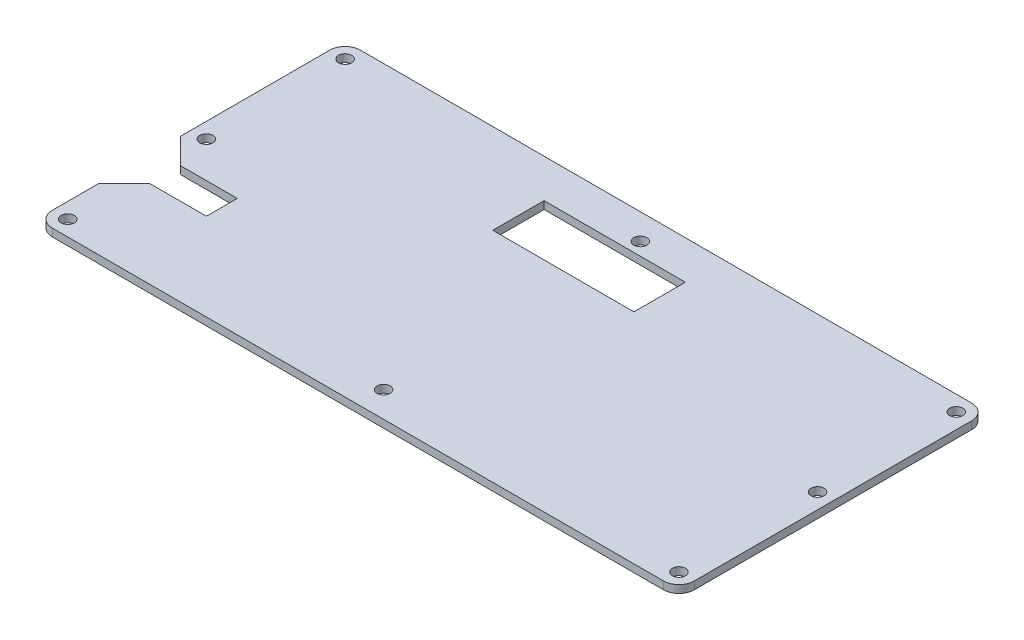
from build123d import *

# Parameters (mm, degrees)
SKETCH_1_R      = 2.55
SKETCH_1_W      = 55
SKETCH_1_H      = 20
EXTRUDE_1_DEPTH = 3


with BuildPart() as part:
    # 草图1 → 凸台-拉伸1 (new body)
    with BuildSketch(Plane(origin=(0, 0, 0), x_dir=(1, 0, 0), z_dir=(0, 1, 0))):
        with BuildLine():
            Line((16.20771131, 68.233643966), (16.20771131, 126.233643966))
            ThreePointArc((16.20771131, 126.233643966), (17.965070623, 130.476284653), (22.20771131, 132.233643966))
            Line((22.20771131, 132.233643966), (260.20771131, 132.233643966))
            ThreePointArc((260.20771131, 132.233643966), (264.450351998, 130.476284653), (266.20771131, 126.233643966))
            Line((266.20771131, 126.233643966), (266.20771131, 18.233643966))
            ThreePointArc((266.20771131, 18.233643966), (264.450351998, 13.991003279), (260.20771131, 12.233643966))
            Line((260.20771131, 12.233643966), (22.20771131, 12.233643966))
            ThreePointArc((22.20771131, 12.233643966), (17.965070623, 13.991003279), (16.20771131, 18.233643966))
            Line((16.20771131, 18.233643966), (16.20771131, 36.233643966))
            Line((16.20771131, 36.233643966), (26.20771131, 46.233643966))
            Line((26.20771131, 46.233643966), (48.20771131, 46.233643966))
            Line((48.20771131, 46.233643966), (48.20771131, 58.233643966))
            Line((48.20771131, 58.233643966), (26.20771131, 58.233643966))
            Line((26.20771131, 58.233643966), (16.20771131, 68.233643966))
        make_face()
        with Locations(Location((22.20771131, 126.233643966, 0), (0, 0, 270))):
            Circle(SKETCH_1_R, mode=Mode.SUBTRACT)
        with Locations(Location((260.20771131, 126.233643966, 0), (0, 0, 270))):
            Circle(SKETCH_1_R, mode=Mode.SUBTRACT)
        with Locations(Location((141.20771131, 122.233643966, 0), (0, 0, 270))):
            Circle(SKETCH_1_R, mode=Mode.SUBTRACT)
        with Locations(Location((22.20771131, 18.233643966, 0), (0, 0, 270))):
            Circle(SKETCH_1_R, mode=Mode.SUBTRACT)
        with Locations(Location((260.20771131, 18.233643966, 0), (0, 0, 270))):
            Circle(SKETCH_1_R, mode=Mode.SUBTRACT)
        with Locations(Location((141.20771131, 22.233643966, 0), (0, 0, 270))):
            Circle(SKETCH_1_R, mode=Mode.SUBTRACT)
        with Locations(Location((260.20771131, 72.233643966, 0), (0, 0, 270))):
            Circle(SKETCH_1_R, mode=Mode.SUBTRACT)
        with Locations(Location((22.20771131, 72.233643966, 0), (0, 0, 270))):
            Circle(SKETCH_1_R, mode=Mode.SUBTRACT)
        with Locations((136.20771131, 107.233643966)):
            Rectangle(SKETCH_1_W, SKETCH_1_H, mode=Mode.SUBTRACT)
    extrude(amount=EXTRUDE_1_DEPTH)


solid = part.part
